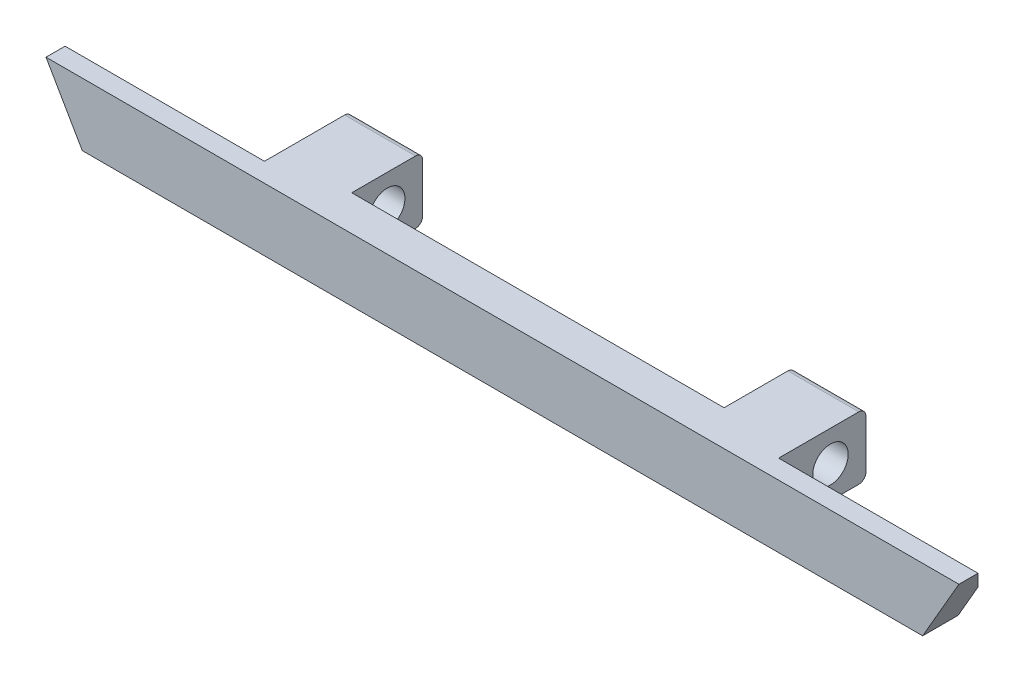
from build123d import *
from OCP.BRepFilletAPI import BRepFilletAPI_MakeChamfer

# Parameters (mm, degrees)
BOSS_EXTRUDE1_DEPTH = 50
BOSS_EXTRUDE2_DEPTH = 100
SKETCH3_R           = 25
CUT_EXTRUDE1_DEPTH  = 1015.958328012
FILLET1_R           = 10
CHAMFER1_SIZE       = 40
CHAMFER1_SIZE2      = 23.094010768


with BuildPart() as part:
    # Sketch1 → Boss-Extrude1 (new body)
    with BuildSketch(Plane.XY):
        Polygon((0, 0), (592.5, 0), (643.63, 88.559757791), (-643.63, 88.559757791), (-592.5, 0), align=None)
    extrude(amount=BOSS_EXTRUDE1_DEPTH)

    # Sketch2 → Boss-Extrude2 (add)
    with BuildSketch(Plane(origin=(0, 0, 0), x_dir=(-1, 0, 0), z_dir=(0, 0, -1))):
        Polygon((-312.5, 0), (-262.5, 0), (-262.5, 88.559757791), (-362.5, 88.559757791), (-362.5, 0), align=None)
        Polygon((262.5, 88.559757791), (262.5, 0), (312.5, 0), (362.5, 0), (362.5, 88.559757791), align=None)
    extrude(amount=BOSS_EXTRUDE2_DEPTH)

    # Sketch3 → Cut-Extrude1 (cut, through all)
    with BuildSketch(Plane(origin=(362.5, 0, 0), x_dir=(0, 0, -1), z_dir=(1, 0, 0))):
        with Locations((50, 44.279878895)):
            Circle(SKETCH3_R)
    extrude(amount=-CUT_EXTRUDE1_DEPTH, mode=Mode.SUBTRACT)

    # Fillet1
    fillet1_edges = [part.edges().sort_by_distance(p)[0] for p in [
        (-312.5, 88.559757791, -100),
        (-312.5, 0, -100),
        (312.5, 88.559757791, -100),
        (312.5, 0, -100),
    ]]
    fillet(fillet1_edges, radius=FILLET1_R)

    # Chamfer1: one chamfer whose edges measure the first distance from different faces: ONE call of the kernel's chamfer builder (chamfer() names one face for all edges)
    chamfer1_edges_1 = [part.edges().sort_by_distance(p)[0] for p in [
        (-503.065, 88.559757791, 0),
    ]]
    chamfer1_side_1 = [part.faces().sort_by_distance(p)[0] for p in [
        (-490.708725047, 45.75636577, 0),
    ]]
    chamfer1_edges_2 = [part.edges().sort_by_distance(p)[0] for p in [
        (503.065, 88.559757791, 0),
    ]]
    chamfer1_side_2 = [part.faces().sort_by_distance(p)[0] for p in [
        (490.708725047, 45.75636577, 0),
    ]]
    chamfer1 = BRepFilletAPI_MakeChamfer(part.part.solid().wrapped)
    for e in chamfer1_edges_1:
        chamfer1.Add(CHAMFER1_SIZE, CHAMFER1_SIZE2, e.wrapped, chamfer1_side_1[0].wrapped)  # the first distance lies on this face
    for e in chamfer1_edges_2:
        chamfer1.Add(CHAMFER1_SIZE, CHAMFER1_SIZE2, e.wrapped, chamfer1_side_2[0].wrapped)  # the first distance lies on this face
    add(Compound.cast(chamfer1.Shape()), mode=Mode.REPLACE)


solid = part.part
